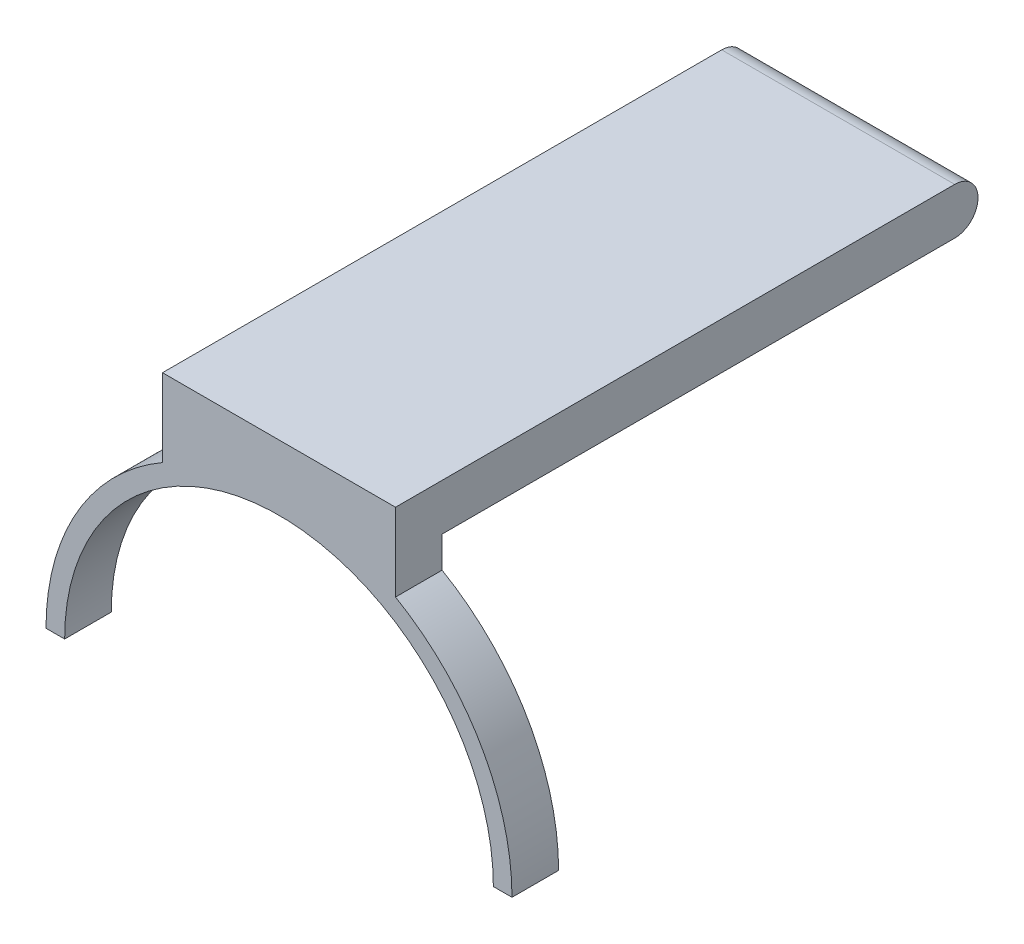
from build123d import *

# Parameters (mm, degrees)
SKETCH_1_W      = 50
SKETCH_1_H      = 10
EXTRUDE_1_DEPTH = 120
EXTRUDE_2_DEPTH = 10
SKETCH_2_R      = 5
EXTRUDE_3_DEPTH = 50


with BuildPart() as part:
    # 草图1 → 凸台-拉伸1 (new body)
    with BuildSketch(Plane.XY):
        Rectangle(SKETCH_1_W, SKETCH_1_H)
    extrude(amount=EXTRUDE_1_DEPTH)

    # 草图3 → 凸台-拉伸2 (add)
    with BuildSketch(Plane.XY.offset(120)):
        with BuildLine():
            Line((-50, -55), (-46, -55))
            ThreePointArc((-46, -55), (0, -9), (46, -55))
            Line((46, -55), (50, -55))
            ThreePointArc((50, -55), (43.301270189, -30), (25, -11.698729811))
            Line((25, -11.698729811), (25, -5))
            Line((25, -5), (-25, -5))
            Line((-25, -5), (-25, -11.698729811))
            ThreePointArc((-25, -11.698729811), (-43.301270189, -30), (-50, -55))
        make_face()
    extrude(amount=-EXTRUDE_2_DEPTH)

    # 草图2 → 凸台-拉伸3 (add)
    with BuildSketch(Plane(origin=(25, 0, 0), x_dir=(0, 0, -1), z_dir=(1, 0, 0))):
        Circle(SKETCH_2_R)
    extrude(amount=-EXTRUDE_3_DEPTH)


solid = part.part
